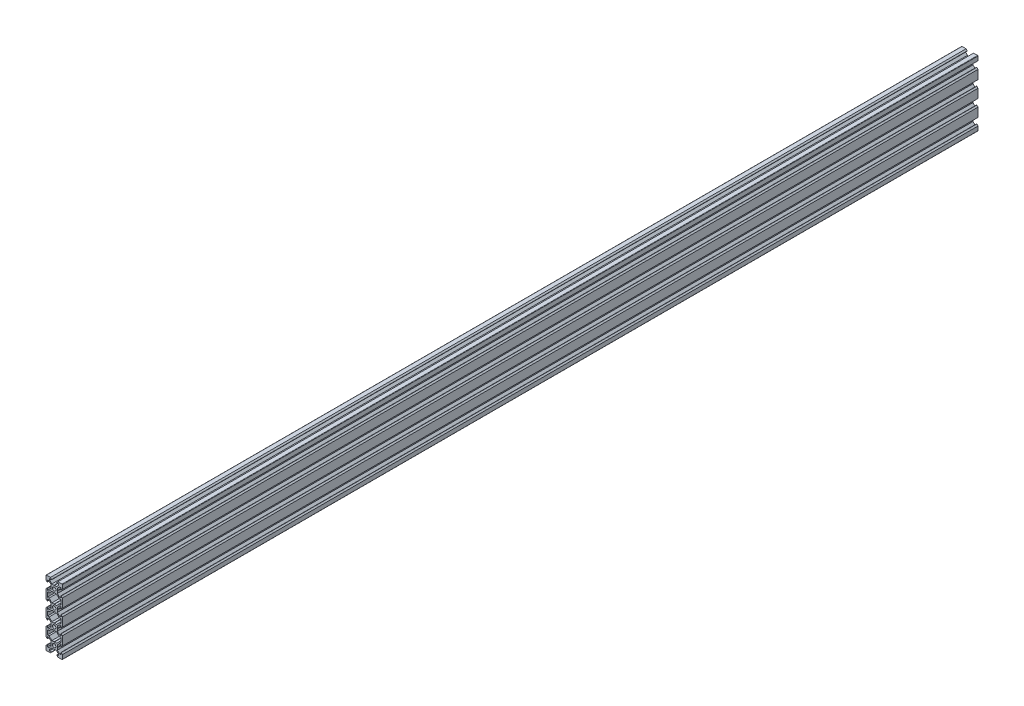
from build123d import *

# Parameters (mm, degrees)
BOSS_EXTRU_1_DEPTH = 1120


with BuildPart() as part:
    # Esquisse1 → Boss.-Extru.1 (new body)
    with BuildSketch(Plane.XY):
        with BuildLine():
            Line((-9.5, 10), (-4.58, 10))
            Line((-4.58, 10), (-3.125, 8.545))
            Line((-3.125, 8.545), (-3.125, 8.2))
            Line((-3.125, 8.2), (-5.5, 8.2))
            Line((-5.5, 8.2), (-5.5, 6.560660172))
            Line((-5.5, 6.560660172), (-2.839339828, 3.9))
            Line((-2.839339828, 3.9), (-0.21, 3.9))
            Line((-0.21, 3.9), (0, 3.69))
            Line((0, 3.69), (0, 2.1))
            ThreePointArc((0, 2.1), (-2.1, 0), (0, -2.1))
            Line((0, -2.1), (0, -3.69))
            Line((0, -3.69), (-0.21, -3.9))
            Line((-0.21, -3.9), (-2.839339828, -3.9))
            Line((-2.839339828, -3.9), (-6.239339828, -7.3))
            Line((-6.239339828, -7.3), (-8.2, -7.3))
            Line((-8.2, -7.3), (-8.2, -12.7))
            Line((-8.2, -12.7), (-6.239339828, -12.7))
            Line((-6.239339828, -12.7), (-2.839339828, -16.1))
            Line((-2.839339828, -16.1), (-0.21, -16.1))
            Line((-0.21, -16.1), (0, -16.31))
            Line((0, -16.31), (0, -17.9))
            ThreePointArc((0, -17.9), (-2.1, -20), (0, -22.1))
            Line((0, -22.1), (0, -23.69))
            Line((0, -23.69), (-0.21, -23.9))
            Line((-0.21, -23.9), (-2.839339828, -23.9))
            Line((-2.839339828, -23.9), (-6.239339828, -27.3))
            Line((-6.239339828, -27.3), (-8.2, -27.3))
            Line((-8.2, -27.3), (-8.2, -32.7))
            Line((-8.2, -32.7), (-6.239339828, -32.7))
            Line((-6.239339828, -32.7), (-2.839339828, -36.1))
            Line((-2.839339828, -36.1), (-0.21, -36.1))
            Line((-0.21, -36.1), (0, -36.31))
            Line((0, -36.31), (0, -37.9))
            ThreePointArc((0, -37.9), (-2.1, -40), (0, -42.1))
            Line((0, -42.1), (0, -43.69))
            Line((0, -43.69), (-0.21, -43.9))
            Line((-0.21, -43.9), (-2.839339828, -43.9))
            Line((-2.839339828, -43.9), (-6.239339828, -47.3))
            Line((-6.239339828, -47.3), (-8.2, -47.3))
            Line((-8.2, -47.3), (-8.2, -52.7))
            Line((-8.2, -52.7), (-6.239339828, -52.7))
            Line((-6.239339828, -52.7), (-2.839339828, -56.1))
            Line((-2.839339828, -56.1), (-0.21, -56.1))
            Line((-0.21, -56.1), (0, -56.31))
            Line((0, -56.31), (0, -57.9))
            ThreePointArc((0, -57.9), (-2.1, -60), (0, -62.1))
            Line((0, -62.1), (0, -63.69))
            Line((0, -63.69), (-0.21, -63.9))
            Line((-0.21, -63.9), (-2.839339828, -63.9))
            Line((-2.839339828, -63.9), (-5.5, -66.560660172))
            Line((-5.5, -66.560660172), (-5.5, -68.2))
            Line((-5.5, -68.2), (-3.125, -68.2))
            Line((-3.125, -68.2), (-3.125, -68.545))
            Line((-3.125, -68.545), (-4.58, -70))
            Line((-4.58, -70), (-9.5, -70))
            ThreePointArc((-9.5, -70), (-9.853553391, -69.853553391), (-10, -69.5))
            Line((-10, -69.5), (-10, -64.58))
            Line((-10, -64.58), (-8.545, -63.125))
            Line((-8.545, -63.125), (-8.2, -63.125))
            Line((-8.2, -63.125), (-8.2, -65.5))
            Line((-8.2, -65.5), (-6.560660172, -65.5))
            Line((-6.560660172, -65.5), (-3.9, -62.839339828))
            Line((-3.9, -62.839339828), (-3.9, -60.21))
            Line((-3.9, -60.21), (-3.69, -60))
            Line((-3.69, -60), (-3.9, -59.79))
            Line((-3.9, -59.79), (-3.9, -57.160660172))
            Line((-3.9, -57.160660172), (-6.560660172, -54.5))
            Line((-6.560660172, -54.5), (-8.2, -54.5))
            Line((-8.2, -54.5), (-8.2, -56.875))
            Line((-8.2, -56.875), (-8.545, -56.875))
            Line((-8.545, -56.875), (-10, -55.42))
            Line((-10, -55.42), (-10, -44.58))
            Line((-10, -44.58), (-8.545, -43.125))
            Line((-8.545, -43.125), (-8.2, -43.125))
            Line((-8.2, -43.125), (-8.2, -45.5))
            Line((-8.2, -45.5), (-6.560660172, -45.5))
            Line((-6.560660172, -45.5), (-3.9, -42.839339828))
            Line((-3.9, -42.839339828), (-3.9, -40.21))
            Line((-3.9, -40.21), (-3.69, -40))
            Line((-3.69, -40), (-3.9, -39.79))
            Line((-3.9, -39.79), (-3.9, -37.160660172))
            Line((-3.9, -37.160660172), (-6.560660172, -34.5))
            Line((-6.560660172, -34.5), (-8.2, -34.5))
            Line((-8.2, -34.5), (-8.2, -36.875))
            Line((-8.2, -36.875), (-8.545, -36.875))
            Line((-8.545, -36.875), (-10, -35.42))
            Line((-10, -35.42), (-10, -24.58))
            Line((-10, -24.58), (-8.545, -23.125))
            Line((-8.545, -23.125), (-8.2, -23.125))
            Line((-8.2, -23.125), (-8.2, -25.5))
            Line((-8.2, -25.5), (-6.560660172, -25.5))
            Line((-6.560660172, -25.5), (-3.9, -22.839339828))
            Line((-3.9, -22.839339828), (-3.9, -20.21))
            Line((-3.9, -20.21), (-3.69, -20))
            Line((-3.69, -20), (-3.9, -19.79))
            Line((-3.9, -19.79), (-3.9, -17.160660172))
            Line((-3.9, -17.160660172), (-6.560660172, -14.5))
            Line((-6.560660172, -14.5), (-8.2, -14.5))
            Line((-8.2, -14.5), (-8.2, -16.875))
            Line((-8.2, -16.875), (-8.545, -16.875))
            Line((-8.545, -16.875), (-10, -15.42))
            Line((-10, -15.42), (-10, -4.58))
            Line((-10, -4.58), (-8.545, -3.125))
            Line((-8.545, -3.125), (-8.2, -3.125))
            Line((-8.2, -3.125), (-8.2, -5.5))
            Line((-8.2, -5.5), (-6.560660172, -5.5))
            Line((-6.560660172, -5.5), (-3.9, -2.839339828))
            Line((-3.9, -2.839339828), (-3.9, -0.21))
            Line((-3.9, -0.21), (-3.69, 0))
            Line((-3.69, 0), (-3.9, 0.21))
            Line((-3.9, 0.21), (-3.9, 2.839339828))
            Line((-3.9, 2.839339828), (-6.560660172, 5.5))
            Line((-6.560660172, 5.5), (-8.2, 5.5))
            Line((-8.2, 5.5), (-8.2, 3.125))
            Line((-8.2, 3.125), (-8.545, 3.125))
            Line((-8.545, 3.125), (-10, 4.58))
            Line((-10, 4.58), (-10, 9.5))
            ThreePointArc((-10, 9.5), (-9.853553391, 9.853553391), (-9.5, 10))
        make_face()
    boss_extru_1 = extrude(amount=BOSS_EXTRU_1_DEPTH)

    # Symétrie1: Boss.-Extru.1 across plane
    add(boss_extru_1.mirror(Plane(origin=(0, 3.69, 1120), x_dir=(0, 0, 1), z_dir=(-1, 0, 0))))


solid = part.part
